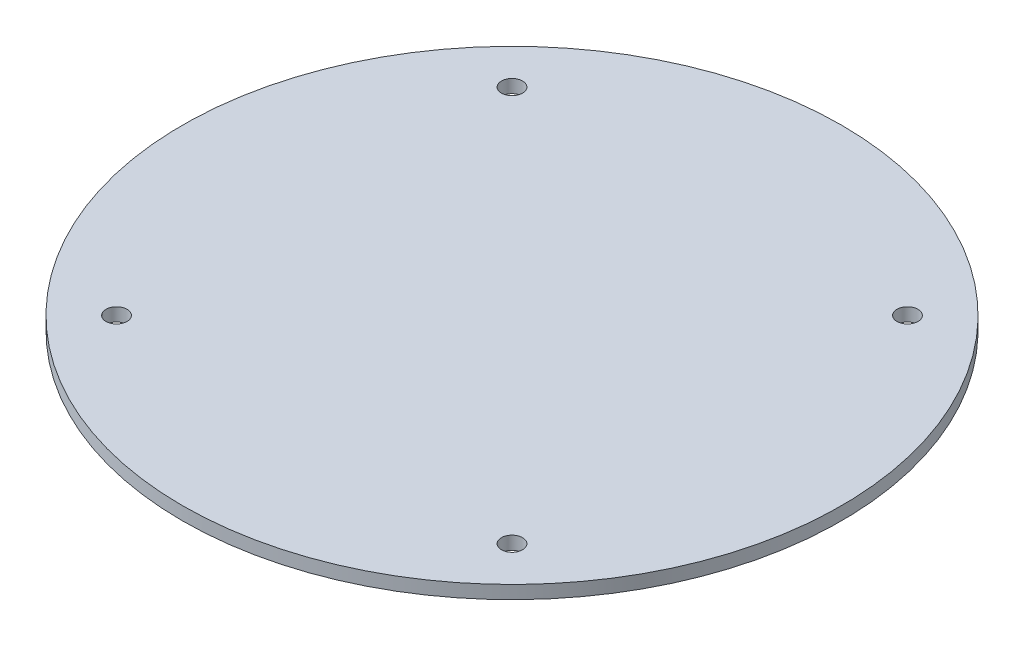
from build123d import *

# Parameters (mm, degrees)
ESQUISSE1_R        = 50
ESQUISSE1_R_2      = 1.6
BOSS_EXTRU_1_DEPTH = 2


with BuildPart() as part:
    # Esquisse1 → Boss.-Extru.1 (new body)
    with BuildSketch(Plane(origin=(0, 0, 0), x_dir=(1, 0, 0), z_dir=(0, 1, 0))):
        with Locations(Location((0, 0, 0), (0, 0, 270))):
            Circle(ESQUISSE1_R)
        with Locations(Location((-30, 30, 0), (0, 0, 270))):
            Circle(ESQUISSE1_R_2, mode=Mode.SUBTRACT)
        with Locations(Location((30, 30, 0), (0, 0, 90))):
            Circle(ESQUISSE1_R_2, mode=Mode.SUBTRACT)
        with Locations(Location((30, -30, 0), (0, 0, 270))):
            Circle(ESQUISSE1_R_2, mode=Mode.SUBTRACT)
        with Locations(Location((-30, -30, 0), (0, 0, 90))):
            Circle(ESQUISSE1_R_2, mode=Mode.SUBTRACT)
    extrude(amount=BOSS_EXTRU_1_DEPTH)


solid = part.part
